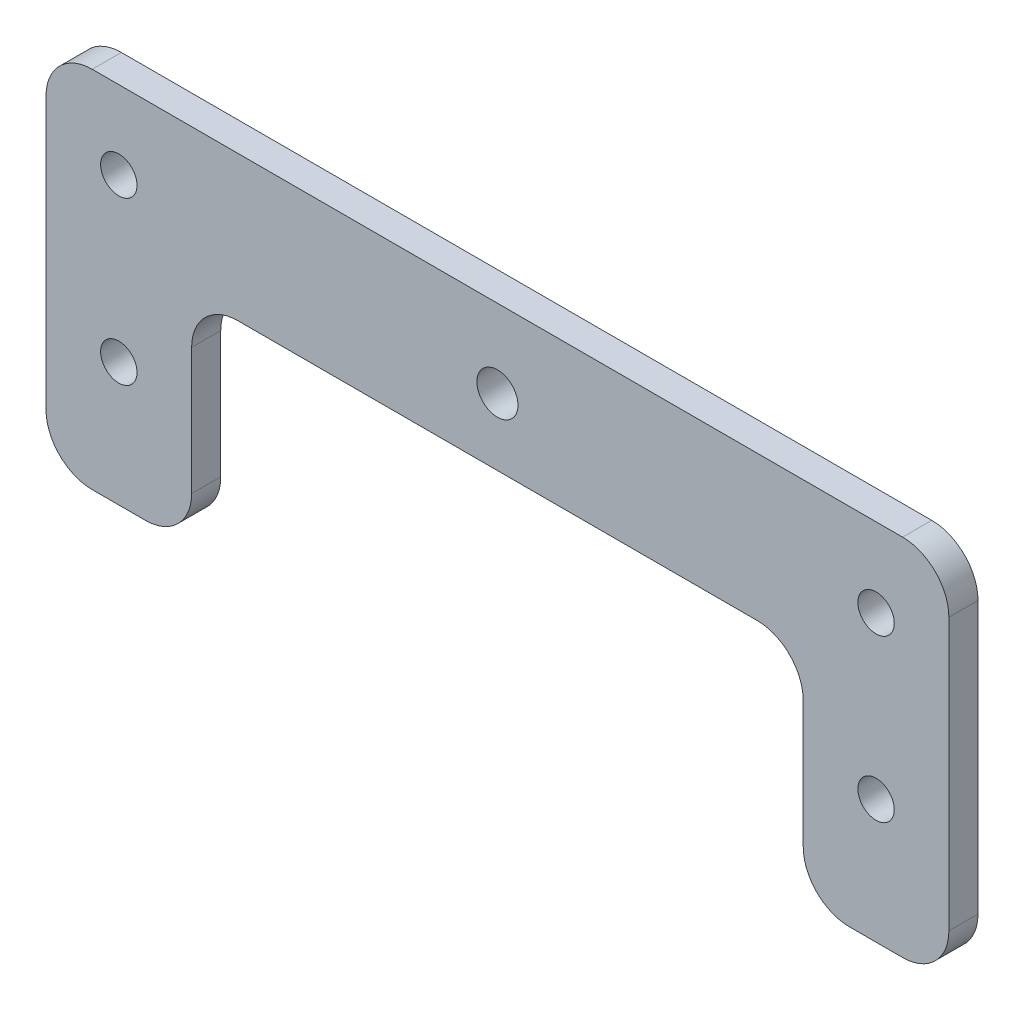
from build123d import *

# Parameters (mm, degrees)
CROQUIS1_R              = 2.5
SALIENTE_EXTRUIR1_DEPTH = 4


with BuildPart() as part:
    # Croquis1 → Saliente-Extruir1 (new body)
    # profile 1 of 2: a face of its own
    with BuildSketch(Plane.XY):
        with BuildLine():
            Line((62.188050923, 13.045129829), (62.188050923, 6.699416954))
            Line((62.188050923, 6.699416954), (97.838050923, 6.699416954))
            ThreePointArc((97.838050923, 6.699416954), (102.328178983, 4.839545014), (104.188050923, 0.349416954))
            Line((104.188050923, 0.349416954), (104.188050923, -17.045643676))
            ThreePointArc((104.188050923, -17.045643676), (106.047922862, -21.535771736), (110.538050923, -23.395643676))
            Line((110.538050923, -23.395643676), (117.838050923, -23.395643676))
            ThreePointArc((117.838050923, -23.395643676), (122.328178983, -21.535771736), (124.188050923, -17.045643676))
            Line((124.188050923, -17.045643676), (124.188050923, 6.604356324))
            Line((124.188050923, 6.604356324), (124.188050923, 20.254356324))
            ThreePointArc((124.188050923, 20.254356324), (122.328178983, 24.744484385), (117.838050923, 26.604356324))
            Line((117.838050923, 26.604356324), (62.188050923, 26.604356324))
            Line((62.188050923, 26.604356324), (62.188050923, 18.687866837))
            ThreePointArc((62.188050923, 18.687866837), (64.183059724, 17.861507134), (65.009419427, 15.866498333))
            ThreePointArc((65.009419427, 15.866498333), (64.183059724, 13.871489531), (62.188050923, 13.045129829))
        make_face()
        with Locations((114.188050923, -6.395643676)):
            Circle(CROQUIS1_R, mode=Mode.SUBTRACT)
        with Locations((114.188050923, 15.771437703)):
            Circle(CROQUIS1_R, mode=Mode.SUBTRACT)
    # profile 2 of 2: a face of its own
    with BuildSketch(Plane.XY):
        with BuildLine():
            ThreePointArc((20.188050923, 0.349416954), (22.047922862, 4.839545014), (26.538050923, 6.699416954))
            Line((26.538050923, 6.699416954), (62.188050923, 6.699416954))
            Line((62.188050923, 6.699416954), (62.188050923, 13.045129829))
            ThreePointArc((62.188050923, 13.045129829), (59.366682419, 15.866498333), (62.188050923, 18.687866837))
            Line((62.188050923, 18.687866837), (62.188050923, 26.604356324))
            Line((62.188050923, 26.604356324), (6.538050923, 26.604356324))
            ThreePointArc((6.538050923, 26.604356324), (2.047922862, 24.744484385), (0.188050923, 20.254356324))
            Line((0.188050923, 20.254356324), (0.188050923, 6.604356324))
            Line((0.188050923, 6.604356324), (0.188050923, -17.045643676))
            ThreePointArc((0.188050923, -17.045643676), (2.047922862, -21.535771736), (6.538050923, -23.395643676))
            Line((6.538050923, -23.395643676), (13.838050923, -23.395643676))
            ThreePointArc((13.838050923, -23.395643676), (18.328178983, -21.535771736), (20.188050923, -17.045643676))
            Line((20.188050923, -17.045643676), (20.188050923, 0.349416954))
        make_face()
        with Locations((10.188050923, -6.395643676)):
            Circle(CROQUIS1_R, mode=Mode.SUBTRACT)
        with Locations((10.188050923, 15.866498333)):
            Circle(CROQUIS1_R, mode=Mode.SUBTRACT)
    extrude(amount=SALIENTE_EXTRUIR1_DEPTH)


solid = part.part
